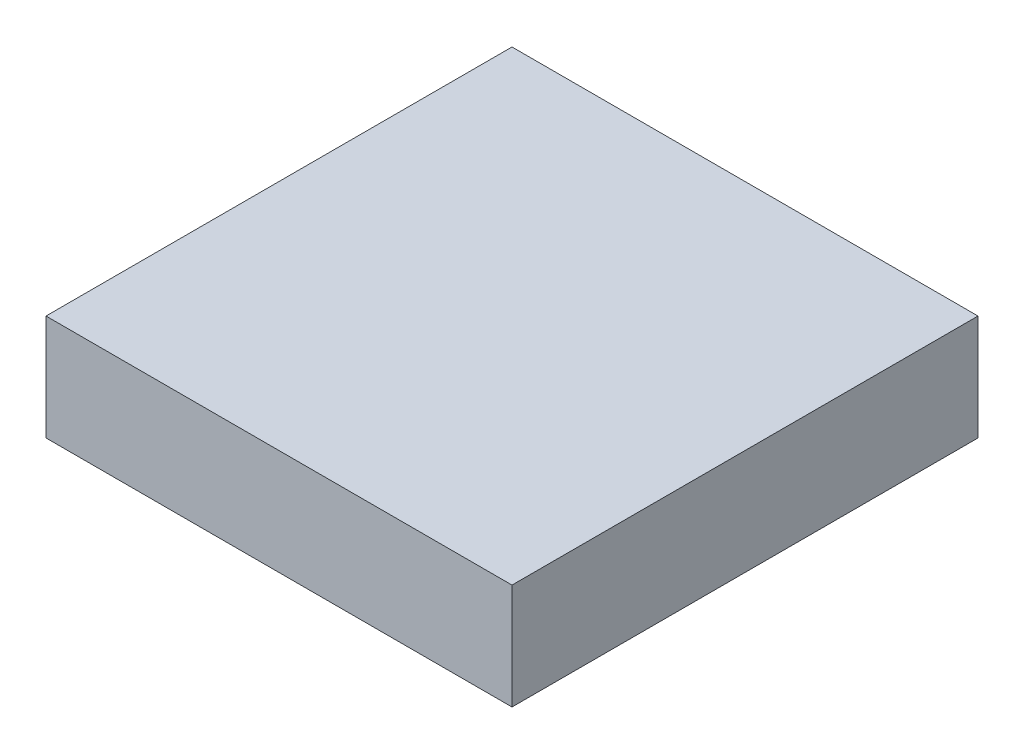
from build123d import *

# Parameters (mm, degrees)
SKETCH1_W           = 150
SKETCH1_H           = 34
BOSS_EXTRUDE1_DEPTH = 150


with BuildPart() as part:
    # Sketch1 → Boss-Extrude1 (new body)
    with BuildSketch(Plane(origin=(0, 0, 0), x_dir=(0, 0, -1), z_dir=(1, 0, 0))):
        with Locations((75, -17)):
            Rectangle(SKETCH1_W, SKETCH1_H)
    extrude(amount=BOSS_EXTRUDE1_DEPTH)


solid = part.part
